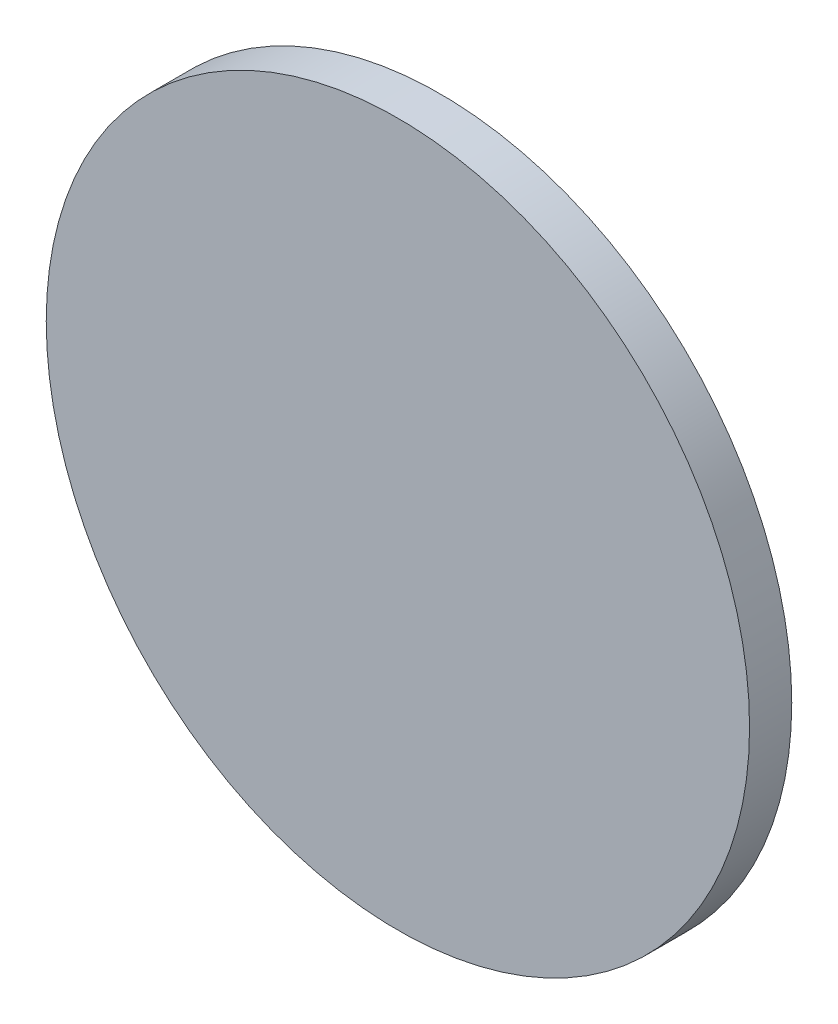
from build123d import *

# Parameters (mm, degrees)
ESQUISSE1_R        = 25
BOSS_EXTRU_1_DEPTH = 3


with BuildPart() as part:
    # Esquisse1 → Boss.-Extru.1 (new body)
    with BuildSketch(Plane.XY):
        Circle(ESQUISSE1_R)
    extrude(amount=BOSS_EXTRU_1_DEPTH)


solid = part.part
